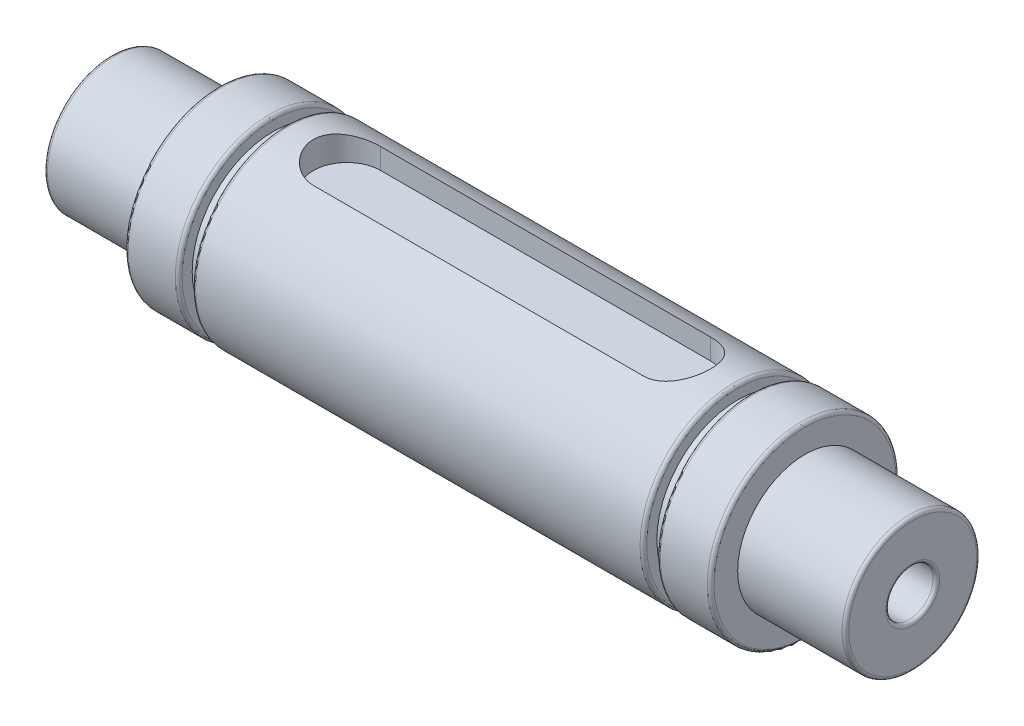
from build123d import *

# Parameters (mm, degrees)
FILLET1_R          = 0.25
FILLET2_R          = 1.5
SKETCH4_R          = 2.5
CUT_EXTRUDE1_DEPTH = 2


with BuildPart() as part:
    # Sketch3 → Revolve1 (revolve)
    with BuildSketch(Plane(origin=(0, 0, 0), x_dir=(1, 0, 0), z_dir=(0, 1, 0)), mode=Mode.PRIVATE) as revolve1_sk:
        Polygon((-29.75, 5), (-21.75, 5), (-21.75, 7), (-17.75, 7), (-17.75, 6), (-16.75, 6), (-16.75, 7), (16.75, 7), (16.75, 6), (17.75, 6), (17.75, 7), (21.75, 7), (21.75, 5), (29.75, 5), (29.75, 1.75), (23.25, 1.75), (23.25, 0), (-23.25, 0), (-23.25, 1.75), (-29.75, 1.75), align=None)
    revolve(revolve1_sk.sketch.rotate(Axis((-23.601699036, 0, 0), (1, 0, 0)), 180), axis=Axis((-23.601699036, 0, 0), (1, 0, 0)))

    # Fillet1
    fillet1_edges = [part.edges().sort_by_distance(p)[0] for p in [
        (-29.75, 0, -1.75),
        (-29.75, 0, -5),
        (-21.75, 0, -7),
        (-17.75, 0, -7),
        (-16.75, 0, -7),
        (16.75, 0, -7),
        (17.75, 0, -7),
        (21.75, 0, -7),
        (29.75, 0, -5),
        (29.75, 0, -1.75),
    ]]
    fillet(fillet1_edges, radius=FILLET1_R)

    # Fillet2
    fillet2_edges = [part.edges().sort_by_distance(p)[0] for p in [
        (-23.25, 0, -1.75),
        (23.25, 0, -1.75),
    ]]
    fillet(fillet2_edges, radius=FILLET2_R)

    # Sketch4 → Cut-Extrude1 (cut)
    with BuildSketch(Plane(origin=(0, 7, 0), x_dir=(1, 0, 0), z_dir=(0, 1, 0))):
        with BuildLine():
            ThreePointArc((-9.75, 0), (-10.482233047, -1.767766953), (-12.25, -2.5))
            Line((-12.25, -2.5), (12.25, -2.5))
            ThreePointArc((12.25, -2.5), (9.75, 0), (12.25, 2.5))
            Line((12.25, 2.5), (-12.25, 2.5))
            ThreePointArc((-12.25, 2.5), (-10.482233047, 1.767766953), (-9.75, 0))
        make_face()
        with Locations((-12.25, 0)):
            Circle(SKETCH4_R)
        with Locations((12.25, 0)):
            Circle(SKETCH4_R)
    extrude(amount=-CUT_EXTRUDE1_DEPTH, mode=Mode.SUBTRACT)


solid = part.part
